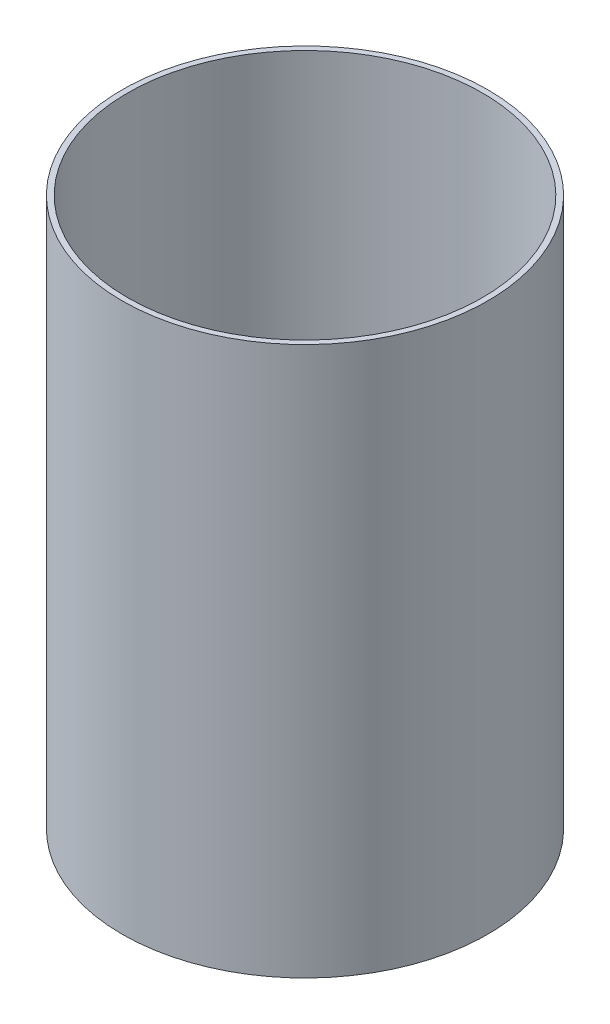
from build123d import *

# Parameters (mm, degrees)
SKETCH1_R           = 100
SKETCH1_R_2         = 97
BOSS_EXTRUDE1_DEPTH = 300


with BuildPart() as part:
    # Sketch1 → Boss-Extrude1 (new body)
    with BuildSketch(Plane(origin=(0, 0, 0), x_dir=(1, 0, 0), z_dir=(0, 1, 0))):
        with Locations(Location((0, 0, 0), (0, 0, 270))):
            Circle(SKETCH1_R)
        with Locations(Location((0, 0, 0), (0, 0, 270))):
            Circle(SKETCH1_R_2, mode=Mode.SUBTRACT)
    extrude(amount=BOSS_EXTRUDE1_DEPTH)


solid = part.part
